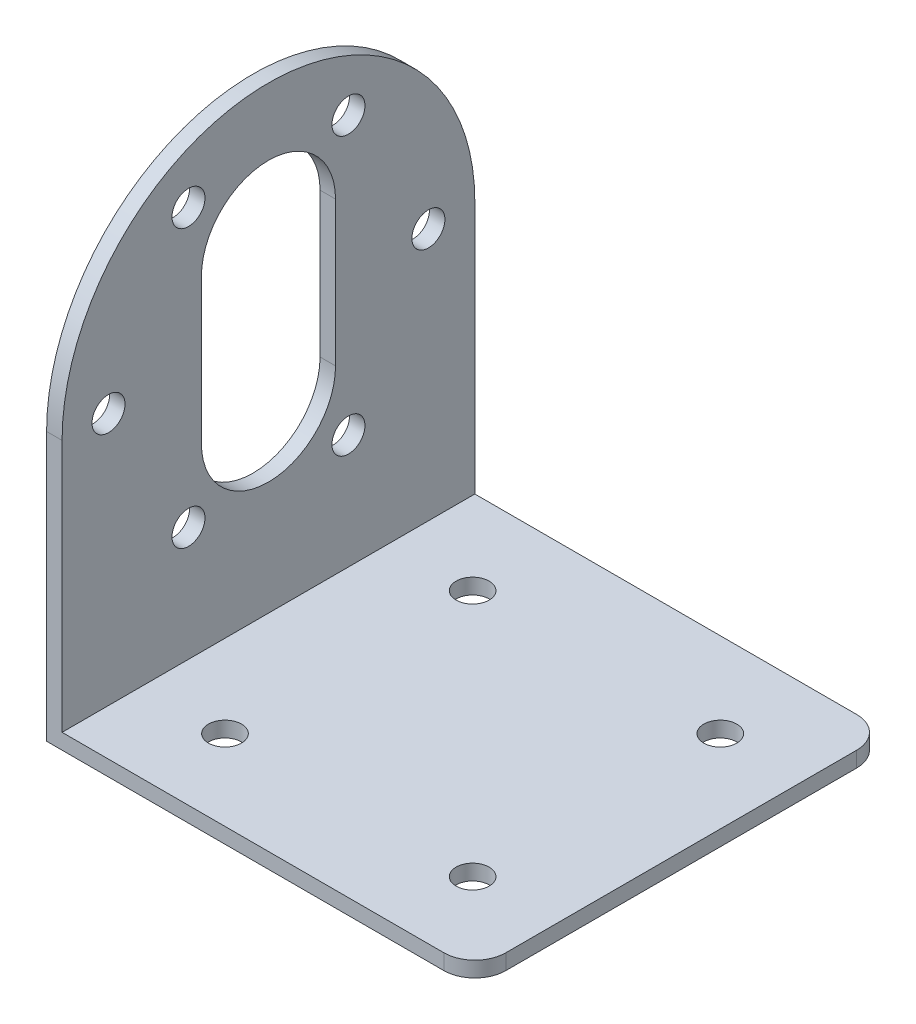
from build123d import *

# Parameters (mm, degrees)
SKETCH_1_W                  = 41.5
SKETCH_1_H                  = 40
EXTRUDE_1_DEPTH             = 1.5
SKETCH_2_W                  = 1.5
SKETCH_2_H                  = 40
EXTRUDE_2_DEPTH             = 44.5
CUT_EXTRUDE_1_DEPTH         = 1.5
HOLE_WIZARD_3_2_3_2_1_D     = 3.2
HOLE_WIZARD_3_2_3_2_2_D     = 3.2
HOLE_WIZARD_3_2_3_2_2_DEPTH = 1.5
HOLE_WIZARD_3_2_3_2_2_TIP   = 0.96137699
FILLET_1_R                  = 3


with BuildPart() as part:
    # 草图1 → 凸台-拉伸1 (new body)
    with BuildSketch(Plane(origin=(0, 0, 0), x_dir=(1, 0, 0), z_dir=(0, 1, 0))):
        with Locations((20.75, 20)):
            Rectangle(SKETCH_1_W, SKETCH_1_H)
    extrude(amount=EXTRUDE_1_DEPTH)

    # 草图2 → 凸台-拉伸2 (add)
    with BuildSketch(Plane(origin=(0, 1.5, 0), x_dir=(1, 0, 0), z_dir=(0, 1, 0))):
        with Locations((0.75, 20)):
            Rectangle(SKETCH_2_W, SKETCH_2_H)
    extrude(amount=EXTRUDE_2_DEPTH)

    # 草图3 → 切除-拉伸1 (cut)
    with BuildSketch(Plane.ZY):
        with BuildLine():
            Line((-40, 46), (-40, 26))
            ThreePointArc((-40, 26), (-34.142135624, 40.142135624), (-20, 46))
            Line((-20, 46), (-40, 46))
        make_face()
        with BuildLine():
            Line((0, 46), (-20, 46))
            ThreePointArc((-20, 46), (-5.857864376, 40.142135624), (0, 26))
            Line((0, 26), (0, 46))
        make_face()
        with BuildLine():
            Line((-26.5, 19), (-26.5, 33))
            ThreePointArc((-26.5, 33), (-20, 39.5), (-13.5, 33))
            Line((-13.5, 33), (-13.5, 19))
            ThreePointArc((-13.5, 19), (-20, 12.5), (-26.5, 19))
        make_face()
    extrude(amount=-CUT_EXTRUDE_1_DEPTH, mode=Mode.SUBTRACT)

    # Ø3.2 (3.2) 直径孔1 (through all)
    with Locations(Plane.ZY):
        with Locations((-12.25, 39.423393759), (-4.5, 26), (-12.25, 12.576606241), (-27.75, 12.576606241), (-35.5, 26), (-27.75, 39.423393759)):
            Hole(HOLE_WIZARD_3_2_3_2_1_D / 2)

    # Ø3.2 (3.2) 直径孔2
    with Locations(Plane(origin=(0, 0, 0), x_dir=(-1, 0, 0), z_dir=(0, -1, 0))):
        with Locations((-9.5, 31.786000063), (-33.5, 31.786000063), (-33.5, 7.786000063), (-9.5, 7.786000063)):
            Hole(HOLE_WIZARD_3_2_3_2_2_D / 2, depth=HOLE_WIZARD_3_2_3_2_2_DEPTH)
            with Locations((0, 0, -(HOLE_WIZARD_3_2_3_2_2_DEPTH + HOLE_WIZARD_3_2_3_2_2_TIP / 2))):  # 118° drill point
                Cone(0, HOLE_WIZARD_3_2_3_2_2_D / 2, HOLE_WIZARD_3_2_3_2_2_TIP, mode=Mode.SUBTRACT)

    # 圆角1
    fillet_1_edges = [part.edges().sort_by_distance(p)[0] for p in [
        (41.5, 0.75, -40),
        (41.5, 0.75, 0),
    ]]
    fillet(fillet_1_edges, radius=FILLET_1_R)


solid = part.part
